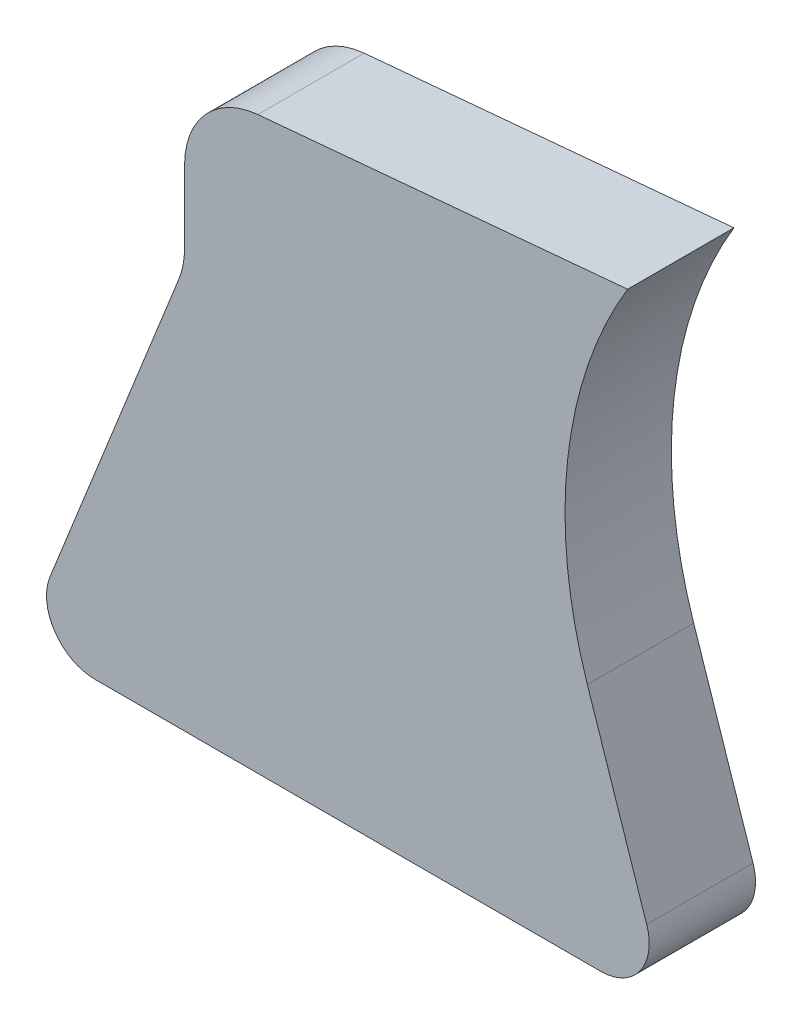
from build123d import *

# Parameters (mm, degrees)
EXTRUDE1_DEPTH = 8.382
FILLET1_R      = 6.35
FILLET2_R      = 3.81


with BuildPart() as part:
    # Sketch1 → Extrude1 (new body)
    with BuildSketch(Plane.XY):
        with BuildLine():
            Line((0, 0), (12.7, 31.75))
            Line((12.7, 31.75), (12.7, 44.45))
            Line((12.7, 44.45), (47.625, 47.625))
            ThreePointArc((47.625, 47.625), (42.899438593, 33.68617349), (44.45, 19.05))
            Line((44.45, 19.05), (50.8, 0))
            Line((50.8, 0), (0, 0))
        make_face()
    extrude(amount=EXTRUDE1_DEPTH)

    # Fillet1
    fillet1_edges = [part.edges().sort_by_distance(p)[0] for p in [
        (12.7, 31.75, 4.191),
        (12.7, 44.45, 4.191),
    ]]
    fillet(fillet1_edges, radius=FILLET1_R)

    # Fillet2
    fillet2_edges = [part.edges().sort_by_distance(p)[0] for p in [
        (0, 0, 4.191),
        (50.8, 0, 4.191),
    ]]
    fillet(fillet2_edges, radius=FILLET2_R)


solid = part.part
